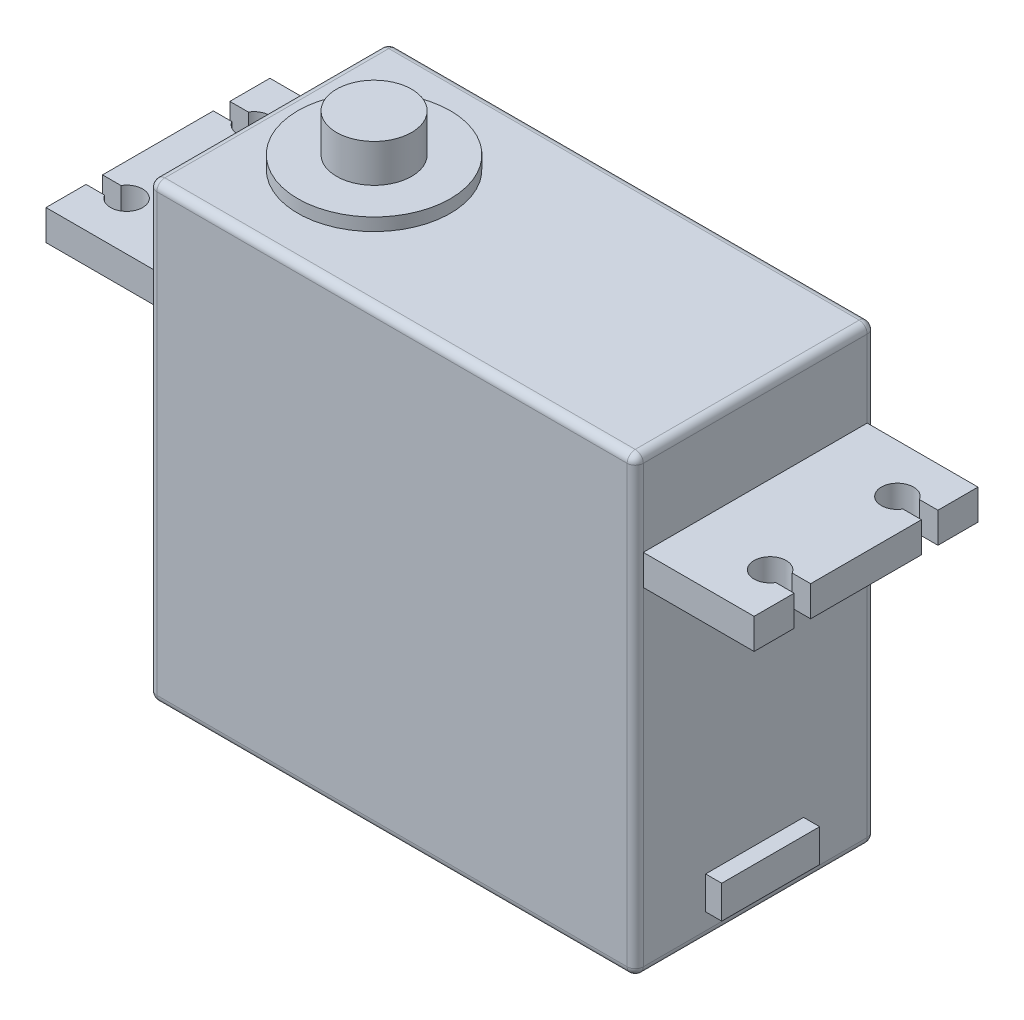
from build123d import *

# Parameters (mm, degrees)
SKETCH1_W           = 38.37
SKETCH1_H           = 35.66
BOSS_EXTRUDE1_DEPTH = 18.93
FILLET1_R           = 0.635
SKETCH3_W           = 17.66
SKETCH3_H           = 2.4
BOSS_EXTRUDE2_DEPTH = 8.74
SKETCH5_R           = 6.015
BOSS_EXTRUDE3_DEPTH = 1
SKETCH7_R           = 2.96
BOSS_EXTRUDE4_DEPTH = 3
SKETCH8_W           = 7.723506563
SKETCH8_H           = 2.58982052
BOSS_EXTRUDE5_DEPTH = 1.27
CUT_EXTRUDE1_REACH  = 54.607


with BuildPart() as part:
    # Sketch1 → Boss-Extrude1 (new body)
    with BuildSketch(Plane.XY):
        with Locations((19.185, 17.83)):
            Rectangle(SKETCH1_W, SKETCH1_H)
    extrude(amount=BOSS_EXTRUDE1_DEPTH)

    # Fillet1
    fillet1_edges = [part.edges().sort_by_distance(p)[0] for p in [
        (38.37, 17.83, 18.93),
        (19.185, 35.66, 18.93),
        (0, 17.83, 18.93),
        (19.185, 35.66, 0),
        (38.37, 17.83, 0),
        (19.185, 0, 0),
        (0, 17.83, 0),
        (0, 35.66, 9.465),
        (38.37, 35.66, 9.465),
        (38.37, 0, 9.465),
        (0, 0, 9.465),
        (19.185, 0, 18.93),
    ]]
    fillet(fillet1_edges, radius=FILLET1_R)

    # Sketch3 → Boss-Extrude2 (add)
    with BuildSketch(Plane.ZY):
        with Locations((9.465, 27.745)):
            Rectangle(SKETCH3_W, SKETCH3_H)
    boss_extrude2 = extrude(amount=BOSS_EXTRUDE2_DEPTH)

    # Sketch5 → Boss-Extrude3 (add)
    with BuildSketch(Plane(origin=(0, 35.66, 0), x_dir=(1, 0, 0), z_dir=(0, 1, 0))):
        with Locations(Location((8.307888536, -9.465, 0), (0, 0, 90))):
            Circle(SKETCH5_R)
    extrude(amount=BOSS_EXTRUDE3_DEPTH)

    # Sketch7 → Boss-Extrude4 (add)
    with BuildSketch(Plane(origin=(0, 36.66, 0), x_dir=(1, 0, 0), z_dir=(0, 1, 0))):
        with Locations(Location((8.307888536, -9.465, 0), (0, 0, 270))):
            Circle(SKETCH7_R)
    extrude(amount=BOSS_EXTRUDE4_DEPTH)

    # Sketch8 → Boss-Extrude5 (add)
    with BuildSketch(Plane(origin=(38.37, 0, 0), x_dir=(0, 0, -1), z_dir=(1, 0, 0))):
        with Locations((-9.516753281, 3.226372892)):
            Rectangle(SKETCH8_W, SKETCH8_H)
    extrude(amount=BOSS_EXTRUDE5_DEPTH)

    # Sketch9 → Cut-Extrude1 (cut, up to next)
    with BuildSketch(Plane(origin=(0, 28.945, 0), x_dir=(1, 0, 0), z_dir=(0, 1, 0)), mode=Mode.PRIVATE) as cut_extrude1_sk1:
        with BuildLine():
            Line((-8.74, -5.094883425), (-7.285254756, -5.094883425))
            ThreePointArc((-7.285254756, -5.094883425), (-4.924130779, -4.445001135), (-7.285253595, -3.795114625))
            Line((-7.285253595, -3.795114625), (-8.74, -3.795114625))
            Line((-8.74, -3.795114625), (-8.74, -5.094883425))
        make_face()
    cut_extrude1_tool1 = extrude(cut_extrude1_sk1.sketch, amount=-CUT_EXTRUDE1_REACH, mode=Mode.PRIVATE) & part.part
    # Sketch9 → Cut-Extrude1 (cut, up to next)
    with BuildSketch(Plane(origin=(0, 28.945, 0), x_dir=(1, 0, 0), z_dir=(0, 1, 0)), mode=Mode.PRIVATE) as cut_extrude1_sk2:
        with BuildLine():
            Line((-8.74, -13.835116616), (-8.74, -15.134883384))
            Line((-8.74, -15.134883384), (-7.285254781, -15.134883384))
            ThreePointArc((-7.285254781, -15.134883384), (-4.924130779, -14.485), (-7.285254781, -13.835116616))
            Line((-7.285254781, -13.835116616), (-8.74, -13.835116616))
        make_face()
    cut_extrude1_tool2 = extrude(cut_extrude1_sk2.sketch, amount=-CUT_EXTRUDE1_REACH, mode=Mode.PRIVATE) & part.part
    cut_extrude1_1 = cut_extrude1_tool1.solids().sort_by_distance((-6.672838, 28.945, 4.445))[0]
    add(cut_extrude1_1, mode=Mode.SUBTRACT)
    cut_extrude1_2 = cut_extrude1_tool2.solids().sort_by_distance((-6.672837, 28.945, 14.485))[0]
    add(cut_extrude1_2, mode=Mode.SUBTRACT)
    cut_extrude1 = cut_extrude1_1 + cut_extrude1_2  # Cut-Extrude1 as one shape, for the pattern or mirror that repeats it

    # Mirror3: Boss-Extrude2, Cut-Extrude1 across plane
    add(boss_extrude2.mirror(Plane.ZY.offset(-19.185)))
    add(cut_extrude1.mirror(Plane.ZY.offset(-19.185)), mode=Mode.SUBTRACT)


solid = part.part
